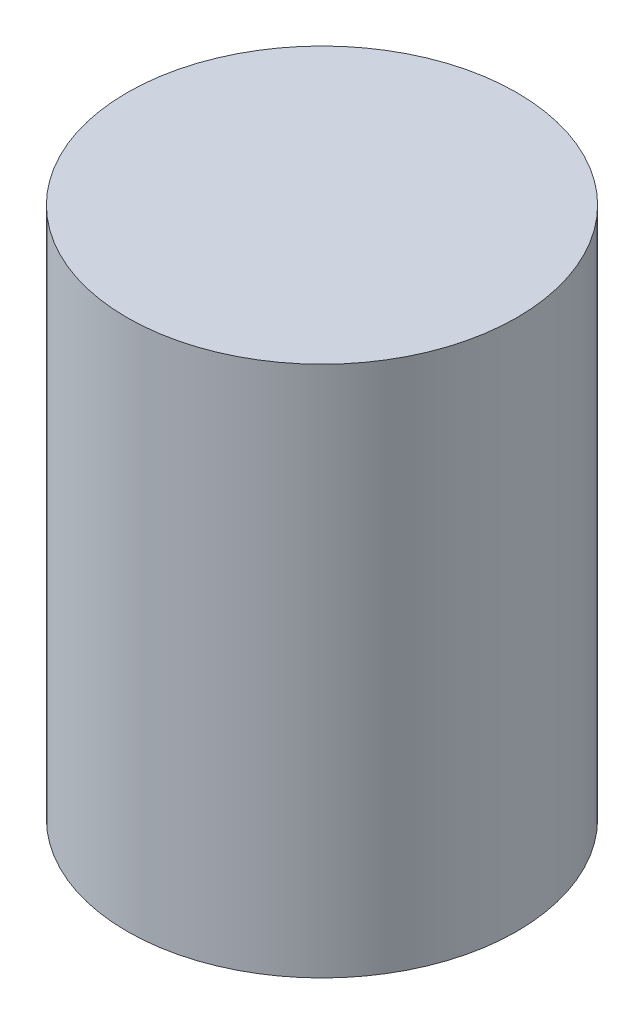
from build123d import *

# Parameters (mm, degrees)
ESBO_O2_W = 2.75
ESBO_O2_H = 7.5


with BuildPart() as part:
    # Esboço2 → Revolução3 (revolve)
    with BuildSketch(Plane(origin=(0, 0, 0), x_dir=(0, 0, -1), z_dir=(1, 0, 0)), mode=Mode.PRIVATE) as revolu_o3_sk:
        with Locations((1.375, 3.75)):
            Rectangle(ESBO_O2_W, ESBO_O2_H)
    revolve(revolu_o3_sk.sketch.rotate(Axis((0, 0, -2.75), (0, 1, 0)), 180), axis=Axis((0, 0, -2.75), (0, 1, 0)))


solid = part.part
